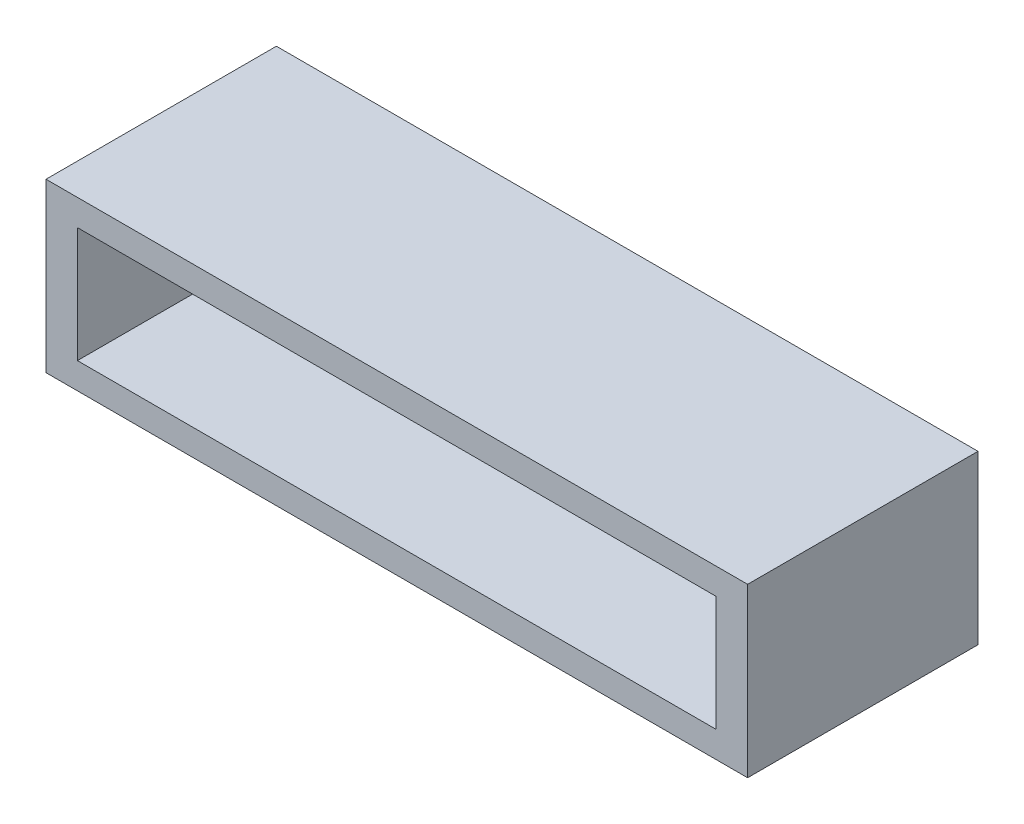
from build123d import *

# Parameters (mm, degrees)
SKETCH_1_W      = 67
SKETCH_1_H      = 16
SKETCH_1_W_2    = 61
SKETCH_1_H_2    = 11
EXTRUDE_1_DEPTH = 22


with BuildPart() as part:
    # 草图1 → 凸台-拉伸1 (new body)
    with BuildSketch(Plane.XY):
        Rectangle(SKETCH_1_W, SKETCH_1_H)
        Rectangle(SKETCH_1_W_2, SKETCH_1_H_2, mode=Mode.SUBTRACT)
    extrude(amount=EXTRUDE_1_DEPTH)


solid = part.part
